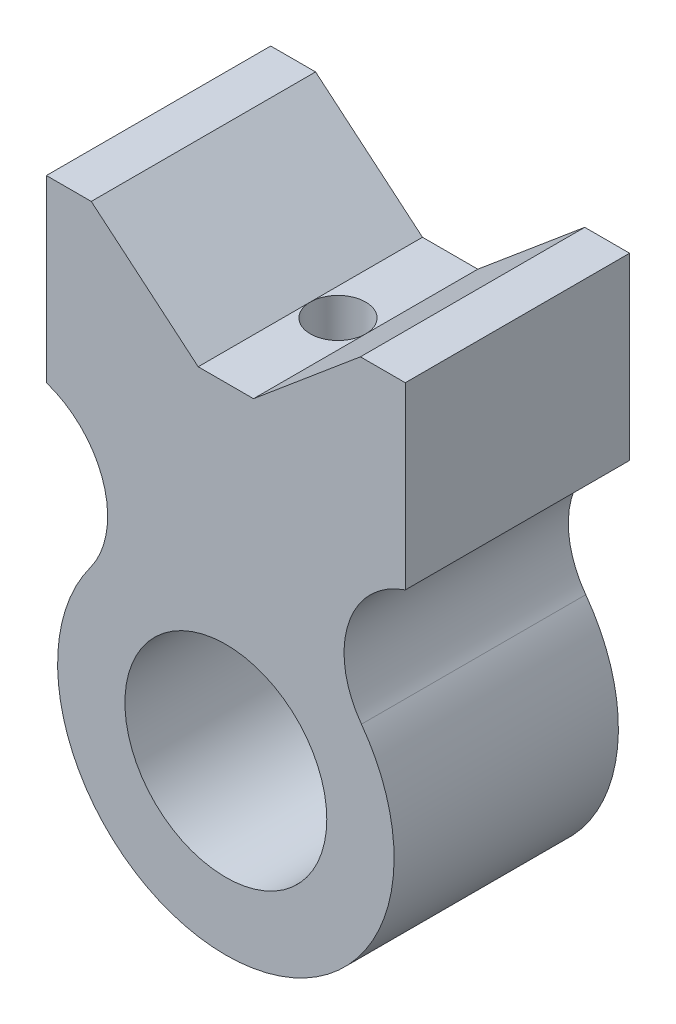
from build123d import *

# Parameters (mm, degrees)
SALIENTE_EXTRUIR1_DEPTH      = 25
SALIENTE_EXTRUIR1_DEPTH_BACK = 25
CROQUIS2_R                   = 22.5
CORTAR_EXTRUIR1_REACH        = 122.147
CROQUIS3_R                   = 6.164928148


with BuildPart() as part:
    # Croquis2 → Saliente-Extruir1 (new, two sides: drawn at the far end of the back side and taken through both)
    with BuildSketch(Plane.XY.offset(-SALIENTE_EXTRUIR1_DEPTH_BACK)):
        with BuildLine():
            Line((-40, 53), (-40, 93))
            Line((-40, 93), (-30, 93))
            Line((-30, 93), (-6.164928148, 73))
            Line((-6.164928148, 73), (6.164928148, 73))
            Line((6.164928148, 73), (30, 93))
            Line((30, 93), (40, 93))
            Line((40, 93), (40, 53))
            ThreePointArc((40, 53), (27.282813289, 40.082394099), (30.225762041, 22.19579485))
            ThreePointArc((30.225762041, 22.19579485), (0, -37.5), (-30.225762041, 22.19579485))
            ThreePointArc((-30.225762041, 22.19579485), (-27.282813289, 40.082394099), (-40, 53))
        make_face()
        Circle(CROQUIS2_R, mode=Mode.SUBTRACT)
    extrude(amount=SALIENTE_EXTRUIR1_DEPTH + SALIENTE_EXTRUIR1_DEPTH_BACK)

    # Croquis3 → Cortar-Extruir1 (cut, up to next)
    with BuildSketch(Plane(origin=(0, 73, 0), x_dir=(1, 0, 0), z_dir=(0, 1, 0)), mode=Mode.PRIVATE) as cortar_extruir1_sk1:
        Circle(CROQUIS3_R)
    cortar_extruir1_tool1 = extrude(cortar_extruir1_sk1.sketch, amount=-CORTAR_EXTRUIR1_REACH, mode=Mode.PRIVATE) & part.part
    add(cortar_extruir1_tool1.solids().sort_by_distance((0, 73, 0))[0], mode=Mode.SUBTRACT)


solid = part.part
